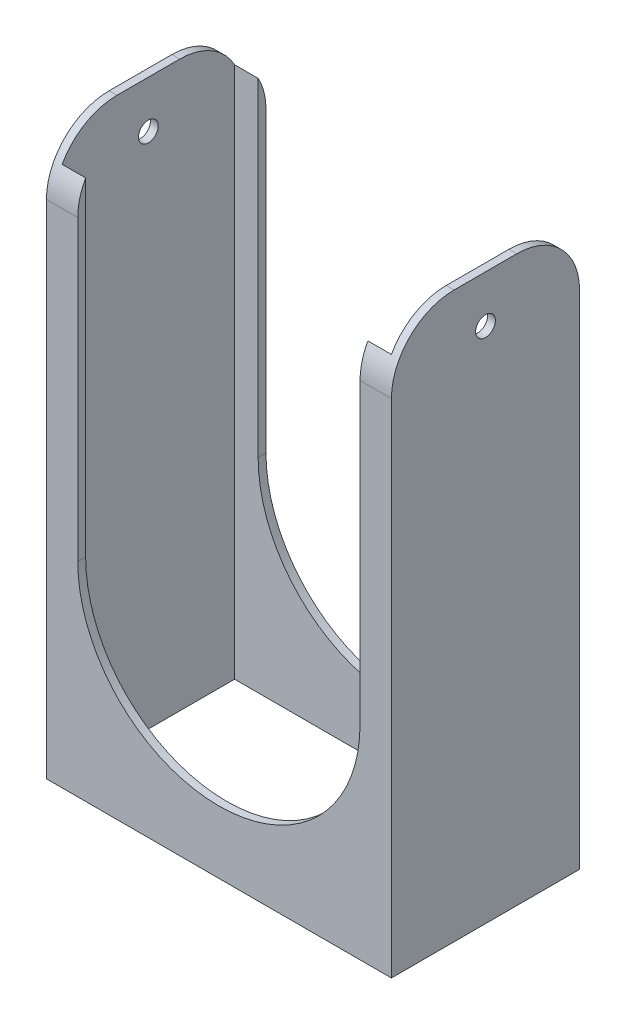
from build123d import *

# Parameters (mm, degrees)
SKETCH1_W               = 139.7
SKETCH1_H               = 76.2
SKETCH1_W_2             = 133.35
SKETCH1_H_2             = 69.85
BOSS_EXTRUDE1_DEPTH     = 228.6
SKETCH2_R               = 4
CUT_EXTRUDE1_DEPTH      = 271.602402059
CUT_EXTRUDE2_DEPTH      = 251.885277567
CUT_EXTRUDE2_DEPTH_BACK = 251.885277567


with BuildPart() as part:
    # Sketch1 → Boss-Extrude1 (new body)
    with BuildSketch(Plane(origin=(0, 0, 0), x_dir=(1, 0, 0), z_dir=(0, 1, 0))):
        Rectangle(SKETCH1_W, SKETCH1_H)
        Rectangle(SKETCH1_W_2, SKETCH1_H_2, mode=Mode.SUBTRACT)
    extrude(amount=BOSS_EXTRUDE1_DEPTH)

    # Sketch2 → Cut-Extrude1 (cut, through all)
    with BuildSketch(Plane(origin=(69.85, 0, 0), x_dir=(0, 0, -1), z_dir=(1, 0, 0))):
        with Locations((0, 209.55)):
            Circle(SKETCH2_R)
        with BuildLine():
            Line((-38.1, 203.2), (-38.1, 228.6))
            Line((-38.1, 228.6), (-12.7, 228.6))
            ThreePointArc((-12.7, 228.6), (-30.660512242, 221.160512242), (-38.1, 203.2))
        make_face()
        with BuildLine():
            Line((12.7, 228.6), (38.1, 228.6))
            Line((38.1, 228.6), (38.1, 203.2))
            ThreePointArc((38.1, 203.2), (30.660512242, 221.160512242), (12.7, 228.6))
        make_face()
    extrude(amount=-CUT_EXTRUDE1_DEPTH, mode=Mode.SUBTRACT)

    # Sketch3 → Cut-Extrude2 (cut, two sides: drawn at the far end of the back side and taken through both)
    with BuildSketch(Plane.XY.offset(38.1).offset(-CUT_EXTRUDE2_DEPTH_BACK)):
        with BuildLine():
            Line((-57.15, 82.55), (-57.15, 228.6))
            Line((-57.15, 228.6), (57.15, 228.6))
            Line((57.15, 228.6), (57.15, 82.55))
            ThreePointArc((57.15, 82.55), (0, 25.4), (-57.15, 82.55))
        make_face()
    extrude(amount=CUT_EXTRUDE2_DEPTH + CUT_EXTRUDE2_DEPTH_BACK, mode=Mode.SUBTRACT)


solid = part.part
